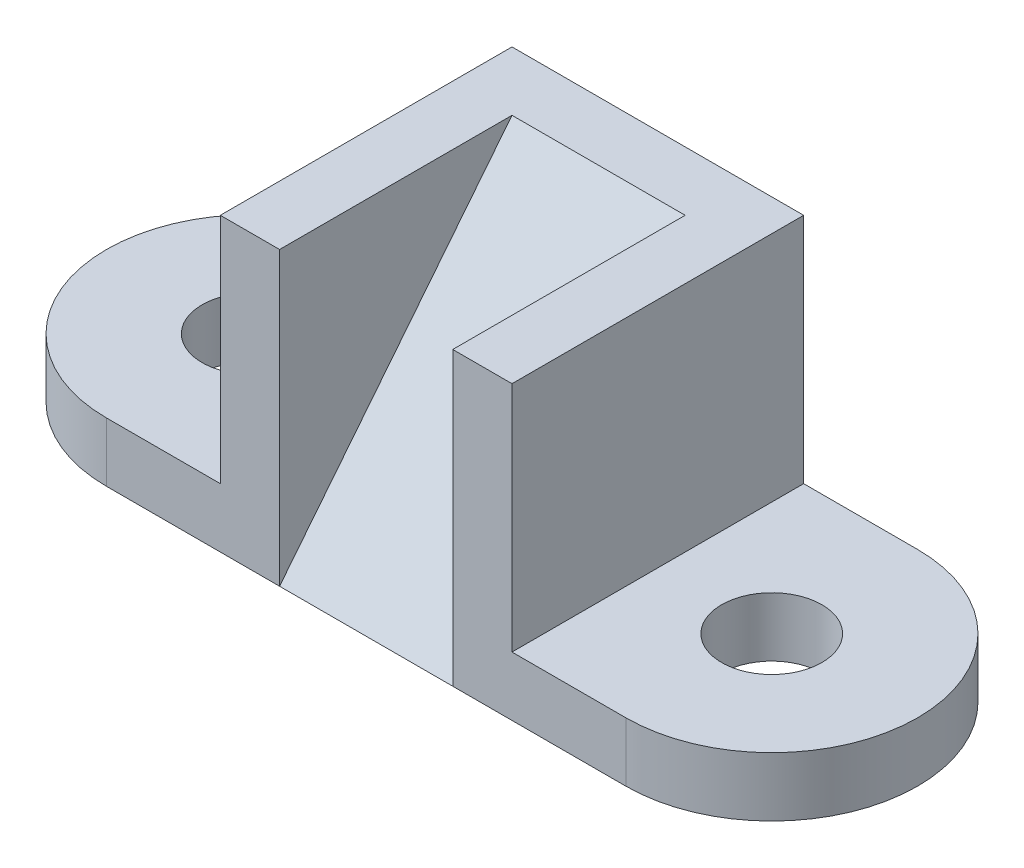
from build123d import *

# Parameters (mm, degrees)
SKETCH1_W               = 64
SKETCH1_H               = 64
BOSS_EXTRUDE1_DEPTH     = 64
CUT_EXTRUDE2_DEPTH      = 97.392449486
CUT_EXTRUDE2_DEPTH_BACK = 64
BOSS_EXTRUDE3_DEPTH     = 64
SKETCH10_R              = 11
BOSS_EXTRUDE4_DEPTH     = 13


with BuildPart() as part:
    # Sketch1 → Boss-Extrude1 (new body)
    with BuildSketch(Plane(origin=(0, 0, 0), x_dir=(1, 0, 0), z_dir=(0, 1, 0))):
        with Locations((1.158774373, 32)):
            Rectangle(SKETCH1_W, SKETCH1_H)
    extrude(amount=-BOSS_EXTRUDE1_DEPTH)

    # Sketch4 → Cut-Extrude2 (cut, two sides: drawn at the far end of the back side and taken through both)
    with BuildSketch(Plane(origin=(0, 0, 0), x_dir=(1, 0, 0), z_dir=(0, 1, 0)).offset(-CUT_EXTRUDE2_DEPTH_BACK)):
        Polygon((20.158774373, -173.670400501), (20.158774373, 0), (20.158774373, 51), (-17.841225627, 51), (-17.841225627, 0), (-17.841225627, -173.670400501), (-17.841225627, -521.011201502), (20.158774373, -521.011201502), align=None)
    extrude(amount=CUT_EXTRUDE2_DEPTH + CUT_EXTRUDE2_DEPTH_BACK, mode=Mode.SUBTRACT)

    # Sketch8 → Boss-Extrude3 (add)
    with BuildSketch(Plane(origin=(33.158774373, 0, 0), x_dir=(0, 0, -1), z_dir=(1, 0, 0))):
        Polygon((51, 0), (0, -64), (51, -64), align=None)
    extrude(amount=-BOSS_EXTRUDE3_DEPTH)

    # Sketch10 → Boss-Extrude4 (add)
    # profile 1 of 2: a face of its own
    with BuildSketch(Plane.XZ.offset(64)):
        with BuildLine():
            Line((-30.841225627, 0), (-55.841225627, 0))
            ThreePointArc((-55.841225627, 0), (-87.841225627, -32), (-55.841225627, -64))
            Line((-55.841225627, -64), (-30.841225627, -64))
            Line((-30.841225627, -64), (-30.841225627, 0))
        make_face()
        with Locations(Location((-55.841225627, -32, 0), (0, 0, 270))):
            Circle(SKETCH10_R, mode=Mode.SUBTRACT)
    # profile 2 of 2: a face of its own
    with BuildSketch(Plane.XZ.offset(64)):
        with BuildLine():
            Line((33.158774373, -64), (58.158774373, -64))
            ThreePointArc((58.158774373, -64), (90.158774373, -32), (58.158774373, 0))
            Line((58.158774373, 0), (33.158774373, 0))
            Line((33.158774373, 0), (33.158774373, -64))
        make_face()
        with Locations(Location((58.158774373, -32, 0), (0, 0, 270))):
            Circle(SKETCH10_R, mode=Mode.SUBTRACT)
    extrude(amount=-BOSS_EXTRUDE4_DEPTH)


solid = part.part
